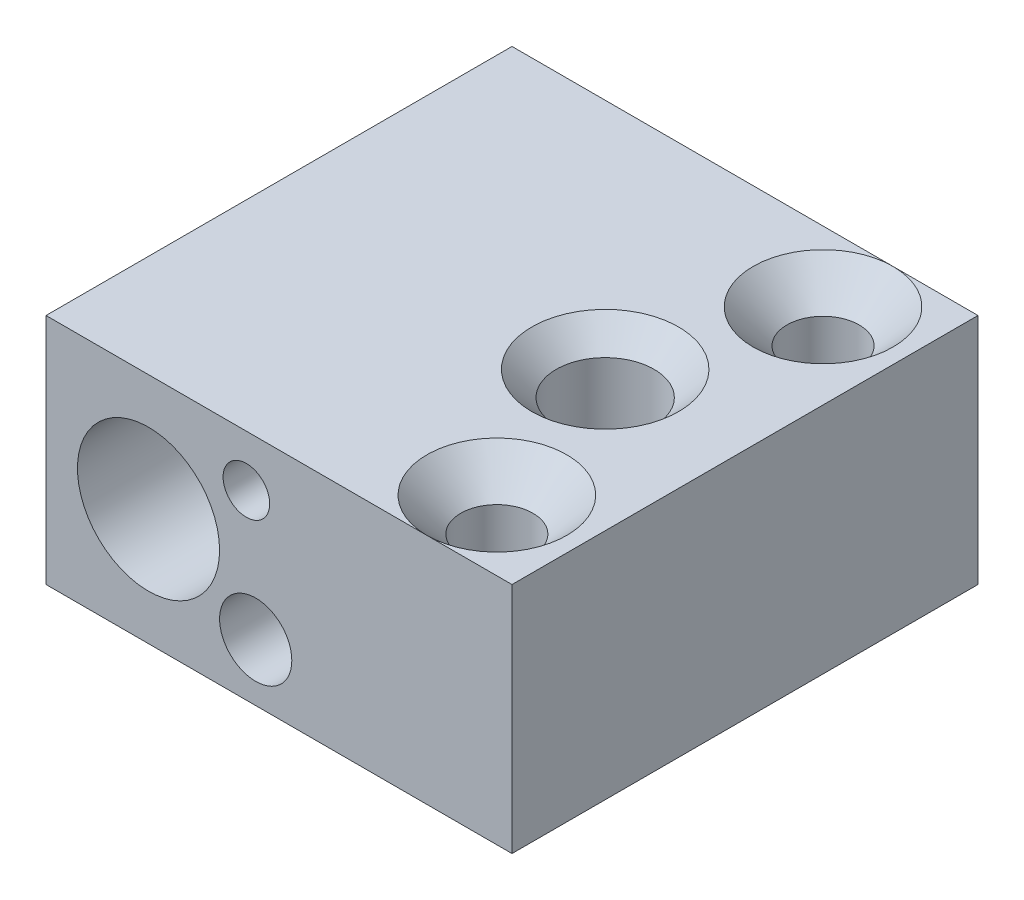
from build123d import *

# Parameters (mm, degrees)
SKETCH_1_W                   = 20
SKETCH_1_H                   = 20
EXTRUDE_1_DEPTH              = 10
M3X0_5_1_AT_2_COUNT          = 2
M3X0_5_1_AT_2_PITCH          = 14
CUT_EXTRUDE_1_REACH          = 26.495
SKETCH_6_R                   = 3.05
SKETCH_6_R_2                 = 1
SKETCH_6_R_3                 = 1.55
HOLE_WIZARD_M3_0_D           = 3.15
HOLE_WIZARD_M3_0_DEPTH       = 6.5
HOLE_WIZARD_M3_0_CSINK_D     = 3.2
HOLE_WIZARD_M3_0_CSINK_ANGLE = 90
HOLE_WIZARD_M3_0_TIP         = 0.946355475
CUT_EXTRUDE_2_DEPTH          = 0.01


with BuildPart() as part:
    # 草图1 → 凸台-拉伸1 (new body)
    with BuildSketch(Plane(origin=(0, 0, 0), x_dir=(1, 0, 0), z_dir=(0, 1, 0))):
        Rectangle(SKETCH_1_W, SKETCH_1_H)
    extrude(amount=EXTRUDE_1_DEPTH)

    # 草图3 → M3x0.5 螺纹孔的螺纹孔钻头1 (revolve, cut)
    with BuildSketch(Plane(origin=(6.35, 10, -7), x_dir=(0, 0, 1), z_dir=(1, 0, 0))):
        Polygon((0, 0), (0, 10), (2.05, 10), (1.55, 9.5), (1.55, 1.45), (3, 0), align=None)
    m3x0_5_1 = revolve(axis=Axis((6.35, 16.35, -7), (0, -1, 0)), mode=Mode.SUBTRACT)

    # M3x0.5 螺纹孔的螺纹孔钻头1 at 2: M3x0.5 螺纹孔的螺纹孔钻头1 ×2
    with Locations(*[(0, 0, i * M3X0_5_1_AT_2_PITCH) for i in range(1, M3X0_5_1_AT_2_COUNT)]):
        add(m3x0_5_1, mode=Mode.SUBTRACT)

    # 草图5 → M5x0.8 螺纹孔的螺纹孔钻头1 (revolve, cut)
    with BuildSketch(Plane(origin=(4, 10, 0), x_dir=(0, 0, 1), z_dir=(1, 0, 0))):
        Polygon((0, 0), (0, 10), (3.15, 10), (2.1, 8.95), (2.1, 1.05), (3.15, 0), align=None)
    revolve(axis=Axis((4, 16.35, 0), (0, -1, 0)), mode=Mode.SUBTRACT)

    # 草图6 → 切除-拉伸1 (cut, up to next)
    with BuildSketch(Plane.XY.offset(10), mode=Mode.PRIVATE) as cut_extrude_1_sk1:
        with Locations((-5.6, 5)):
            Circle(SKETCH_6_R)
    cut_extrude_1_tool1 = extrude(cut_extrude_1_sk1.sketch, amount=-CUT_EXTRUDE_1_REACH, mode=Mode.PRIVATE) & part.part
    # 草图6 → 切除-拉伸1 (cut, up to next)
    with BuildSketch(Plane.XY.offset(10), mode=Mode.PRIVATE) as cut_extrude_1_sk2:
        with Locations((-1.4, 7.8)):
            Circle(SKETCH_6_R_2)
    cut_extrude_1_tool2 = extrude(cut_extrude_1_sk2.sketch, amount=-CUT_EXTRUDE_1_REACH, mode=Mode.PRIVATE) & part.part
    # 草图6 → 切除-拉伸1 (cut, up to next)
    with BuildSketch(Plane.XY.offset(10), mode=Mode.PRIVATE) as cut_extrude_1_sk3:
        with Locations((-1, 2.45)):
            Circle(SKETCH_6_R_3)
    cut_extrude_1_tool3 = extrude(cut_extrude_1_sk3.sketch, amount=-CUT_EXTRUDE_1_REACH, mode=Mode.PRIVATE) & part.part
    add(cut_extrude_1_tool1.solids().sort_by_distance((-5.6, 5, 10))[0], mode=Mode.SUBTRACT)
    add(cut_extrude_1_tool2.solids().sort_by_distance((-1.4, 7.8, 10))[0], mode=Mode.SUBTRACT)
    add(cut_extrude_1_tool3.solids().sort_by_distance((-1, 2.45, 10))[0], mode=Mode.SUBTRACT)

    # M3 螺旋的螺纹孔钻头0
    with Locations(Plane(origin=(0, 0, -10), x_dir=(-1, 0, 0), z_dir=(0, 0, -1))):
        with Locations((-2.5, 5.15)):
            CounterSinkHole(HOLE_WIZARD_M3_0_D / 2, HOLE_WIZARD_M3_0_CSINK_D / 2, depth=HOLE_WIZARD_M3_0_DEPTH, counter_sink_angle=HOLE_WIZARD_M3_0_CSINK_ANGLE)
            with Locations((0, 0, -(HOLE_WIZARD_M3_0_DEPTH + HOLE_WIZARD_M3_0_TIP / 2))):  # 118° drill point
                Cone(0, HOLE_WIZARD_M3_0_D / 2, HOLE_WIZARD_M3_0_TIP, mode=Mode.SUBTRACT)

    # 草图9 → 切除-拉伸2 (cut)
    # profile 1 of 9: a face of its own
    with BuildSketch(Plane(origin=(-10, 0, 0), x_dir=(0, 0, -1), z_dir=(1, 0, 0))):
        with BuildLine():
            Line((6.2, 5.873660714), (6.2, 4.697767857))
            add(Edge.make_bspline(
                [(6.2, 4.697767857), (6.200358961, 4.687905196), (6.201044221, 4.669077299), (6.20807328, 4.642690439), (6.220616073, 4.620496734), (6.237482793, 4.602174231), (6.259354858, 4.587844853), (6.286176058, 4.578562792), (6.317246884, 4.572006842), (6.339542911, 4.57162866), (6.351339286, 4.571428571)],
                knots=[0, 0, 0, 0, 1.049174358, 2.002882139, 2.875847972, 3.739554377, 4.632018306, 5.630138028, 6.746154232, 8, 8, 8, 8], degree=3))
            Line((6.351339286, 4.571428571), (6.965625, 4.571428571))
            add(Edge.make_bspline(
                [(6.965625, 4.571428571), (6.984692148, 4.57167981), (7.022190938, 4.572173914), (7.077081365, 4.5787799), (7.129583034, 4.58858087), (7.179954451, 4.601711359), (7.227704243, 4.619904009), (7.273471708, 4.641119389), (7.316592255, 4.666841546), (7.35681122, 4.696114264), (7.393614648, 4.727736189), (7.425537291, 4.761587493), (7.452989619, 4.796390643), (7.475649375, 4.832635177), (7.492654307, 4.870743152), (7.505350768, 4.909892111), (7.512545921, 4.95063252), (7.513702063, 4.978098644), (7.514285714, 4.991964286)],
                knots=[0, 0, 0, 0, 1.195178097, 2.350521112, 3.461591556, 4.543710384, 5.609813756, 6.661895063, 7.703868969, 8.753007154, 9.778466156, 10.742320682, 11.666453728, 12.554833716, 13.415272869, 14.277128051, 15.130247646, 16, 16, 16, 16], degree=3))
            Line((7.514285714, 4.991964286), (7.514285714, 5.873660714))
            add(Edge.make_bspline(
                [(7.514285714, 5.873660714), (7.513814745, 5.88353703), (7.512912201, 5.902463568), (7.504887724, 5.928951372), (7.490887921, 5.951297107), (7.471572516, 5.969582588), (7.446702711, 5.983521083), (7.416621743, 5.99297665), (7.381521179, 5.999426123), (7.356283797, 5.999800713), (7.342857143, 6)],
                knots=[0, 0, 0, 0, 0.97678859, 1.871874803, 2.706162167, 3.561026909, 4.478761946, 5.504159065, 6.672176254, 8, 8, 8, 8], degree=3))
            add(Edge.make_bspline(
                [(7.342857143, 6), (7.331656067, 5.99979818), (7.310538866, 5.999417693), (7.281197761, 5.992928101), (7.255970172, 5.983358117), (7.235187208, 5.969229032), (7.219207986, 5.950861764), (7.207696491, 5.928562603), (7.2011353, 5.902301778), (7.200390794, 5.88351958), (7.2, 5.873660714)],
                knots=[0, 0, 0, 0, 1.229123109, 2.31724511, 3.286658509, 4.180915277, 5.050729611, 5.936409982, 6.916811699, 8, 8, 8, 8], degree=3))
            Line((7.2, 5.873660714), (7.2, 4.995089286))
            add(Edge.make_bspline(
                [(7.2, 4.995089286), (7.1992565, 4.983962511), (7.197783276, 4.961915105), (7.184808401, 4.930291872), (7.16345097, 4.901971327), (7.13540588, 4.876255756), (7.101116767, 4.854867922), (7.061525506, 4.839818381), (7.017870535, 4.830169041), (6.987256064, 4.829115897), (6.971428571, 4.828571429)],
                knots=[0, 0, 0, 0, 0.85076666, 1.685771294, 2.576038868, 3.553346086, 4.58889191, 5.654930637, 6.787613629, 8, 8, 8, 8], degree=3))
            Line((6.971428571, 4.828571429), (6.514285714, 4.828571429))
            Line((6.514285714, 4.828571429), (6.514285714, 5.873660714))
            add(Edge.make_bspline(
                [(6.514285714, 5.873660714), (6.513814745, 5.88353703), (6.512912201, 5.902463568), (6.504887724, 5.928951372), (6.490887921, 5.951297107), (6.471572516, 5.969582588), (6.446702711, 5.983521083), (6.416621743, 5.99297665), (6.381521179, 5.999426123), (6.356283797, 5.999800713), (6.342857143, 6)],
                knots=[0, 0, 0, 0, 0.97678859, 1.871874803, 2.706162167, 3.561026909, 4.478761946, 5.504159065, 6.672176254, 8, 8, 8, 8], degree=3))
            add(Edge.make_bspline(
                [(6.342857143, 6), (6.331656067, 5.99979818), (6.310538866, 5.999417693), (6.281197761, 5.992928101), (6.255970172, 5.983358117), (6.235187208, 5.969229032), (6.219207986, 5.950861764), (6.207696491, 5.928562603), (6.2011353, 5.902301778), (6.200390794, 5.88351958), (6.2, 5.873660714)],
                knots=[0, 0, 0, 0, 1.229123109, 2.31724511, 3.286658509, 4.180915277, 5.050729611, 5.936409982, 6.916811699, 8, 8, 8, 8], degree=3))
        make_face()
    # profile 2 of 9: a face of its own
    with BuildSketch(Plane(origin=(-10, 0, 0), x_dir=(0, 0, -1), z_dir=(1, 0, 0))):
        with BuildLine():
            add(Edge.make_bspline(
                [(4.974553571, 6), (4.957124363, 5.999714263), (4.922908577, 5.999153323), (4.872628726, 5.993032442), (4.824254567, 5.983757005), (4.77780629, 5.970811285), (4.733291916, 5.954400016), (4.691188532, 5.933541651), (4.650708817, 5.909438339), (4.612746848, 5.8814545), (4.577838429, 5.851109777), (4.546913183, 5.81883406), (4.521399376, 5.78416583), (4.500393363, 5.747902015), (4.483372575, 5.710031845), (4.472121526, 5.670145131), (4.464452907, 5.628567763), (4.463750811, 5.600184901), (4.463392857, 5.585714286)],
                knots=[0, 0, 0, 0, 1.143449473, 2.244738931, 3.319371146, 4.373930084, 5.40622561, 6.428398071, 7.453552806, 8.494819983, 9.519323088, 10.486637564, 11.422369572, 12.337066573, 13.233591591, 14.139221845, 15.051307659, 16, 16, 16, 16], degree=3))
            add(Edge.make_bspline(
                [(4.463392857, 5.585714286), (4.46427017, 5.567034275), (4.466017991, 5.529819148), (4.479537945, 5.475447451), (4.500992171, 5.422932414), (4.521904862, 5.391208133), (4.532589286, 5.375)],
                knots=[0, 0, 0, 0, 0.994021238, 1.980332219, 2.968139178, 4, 4, 4, 4], degree=3))
            add(Edge.make_bspline(
                [(4.532589286, 5.375), (4.545105477, 5.358698437), (4.569755236, 5.326593657), (4.6140221, 5.285253294), (4.662236341, 5.249669572), (4.715766025, 5.220818228), (4.773850951, 5.198542208), (4.83672638, 5.183189319), (4.903978296, 5.172912813), (4.950554544, 5.171933286), (4.974553571, 5.171428571)],
                knots=[0, 0, 0, 0, 0.972003009, 1.914291562, 2.85742328, 3.803578917, 4.785295332, 5.795591789, 6.864149528, 8, 8, 8, 8], degree=3))
            Line((4.974553571, 5.171428571), (5.428571429, 5.171428571))
            Line((5.428571429, 5.171428571), (5.428571429, 5))
            add(Edge.make_bspline(
                [(5.428571429, 5), (5.428024145, 4.988416293), (5.426948962, 4.965659149), (5.414042589, 4.933394578), (5.395295718, 4.903409999), (5.36855877, 4.877369474), (5.336639783, 4.855475783), (5.299773054, 4.83977679), (5.259114729, 4.830215878), (5.230708823, 4.829130643), (5.216071429, 4.828571429)],
                knots=[0, 0, 0, 0, 0.911088662, 1.78990857, 2.710600241, 3.692586731, 4.717568866, 5.756043047, 6.843702314, 8, 8, 8, 8], degree=3))
            Line((5.216071429, 4.828571429), (4.733482143, 4.828571429))
            add(Edge.make_bspline(
                [(4.733482143, 4.828571429), (4.721832943, 4.828373059), (4.699828634, 4.827998356), (4.66921151, 4.821431829), (4.642583123, 4.812118383), (4.621145286, 4.797449724), (4.604193008, 4.778903128), (4.592777222, 4.75601124), (4.585260005, 4.729336025), (4.584682036, 4.710177574), (4.584375, 4.7)],
                knots=[0, 0, 0, 0, 1.23741194, 2.337361837, 3.32016584, 4.221015329, 5.073621877, 5.966494756, 6.919737855, 8, 8, 8, 8], degree=3))
            add(Edge.make_bspline(
                [(4.584375, 4.7), (4.584724419, 4.689985241), (4.585391766, 4.670858324), (4.592532754, 4.644160759), (4.604509546, 4.621494572), (4.62081183, 4.602446442), (4.642872869, 4.588577854), (4.66900734, 4.57822655), (4.699934181, 4.572779208), (4.721856817, 4.571896606), (4.733482143, 4.571428571)],
                knots=[0, 0, 0, 0, 1.065522985, 2.035013566, 2.914736256, 3.780045738, 4.67296394, 5.66248319, 6.760441272, 8, 8, 8, 8], degree=3))
            Line((4.733482143, 4.571428571), (5.216071429, 4.571428571))
            add(Edge.make_bspline(
                [(5.216071429, 4.571428571), (5.234843058, 4.571673724), (5.271752536, 4.572155753), (5.325727389, 4.578843839), (5.377327799, 4.588326315), (5.426070813, 4.602405921), (5.472525729, 4.619532205), (5.515855931, 4.641870882), (5.557223257, 4.667134153), (5.595261292, 4.696601152), (5.629877844, 4.728328197), (5.659968696, 4.7620617), (5.685712318, 4.796863729), (5.706349096, 4.83336484), (5.722608216, 4.871074443), (5.734181528, 4.910179361), (5.741729602, 4.950602015), (5.742478964, 4.978091304), (5.742857143, 4.991964286)],
                knots=[0, 0, 0, 0, 1.202798304, 2.364986813, 3.482123764, 4.563358182, 5.61419173, 6.651071682, 7.683684711, 8.718015423, 9.730823015, 10.690367257, 11.612119412, 12.500887244, 13.372851679, 14.239212609, 15.111385823, 16, 16, 16, 16], degree=3))
            Line((5.742857143, 4.991964286), (5.742857143, 5.873660714))
            add(Edge.make_bspline(
                [(5.742857143, 5.873660714), (5.742386174, 5.88353703), (5.74148363, 5.902463568), (5.733459153, 5.928951372), (5.71945935, 5.951297107), (5.700143944, 5.969582588), (5.67527414, 5.983521083), (5.645193172, 5.99297665), (5.610092607, 5.999426123), (5.584855226, 5.999800713), (5.571428571, 6)],
                knots=[0, 0, 0, 0, 0.97678859, 1.871874803, 2.706162167, 3.561026909, 4.478761946, 5.504159065, 6.672176254, 8, 8, 8, 8], degree=3))
            Line((5.571428571, 6), (4.974553571, 6))
        make_face()
        with BuildLine():
            Line((5.428571429, 5.428571429), (4.974553571, 5.428571429))
            add(Edge.make_bspline(
                [(4.974553571, 5.428571429), (4.962591729, 5.429031936), (4.939274445, 5.429929605), (4.905625564, 5.438578661), (4.873911428, 5.451235836), (4.84558103, 5.470096113), (4.821227579, 5.492959644), (4.803117394, 5.52050683), (4.79266188, 5.55210769), (4.791315059, 5.574328961), (4.790625, 5.585714286)],
                knots=[0, 0, 0, 0, 1.06190605, 2.069979262, 3.072912099, 4.086186067, 5.078493479, 6.025723525, 6.988456646, 8, 8, 8, 8], degree=3))
            add(Edge.make_bspline(
                [(4.790625, 5.585714286), (4.791282423, 5.597107013), (4.792549247, 5.619060293), (4.803282122, 5.650383216), (4.821730283, 5.677566854), (4.846447866, 5.700556008), (4.875303006, 5.718839158), (4.906382455, 5.73320635), (4.939917338, 5.741332777), (4.962905287, 5.742344493), (4.974553571, 5.742857143)],
                knots=[0, 0, 0, 0, 1.014738308, 1.955355606, 2.912878804, 3.91792736, 4.945529001, 5.949963358, 6.961220564, 8, 8, 8, 8], degree=3))
            Line((4.974553571, 5.742857143), (5.428571429, 5.742857143))
            Line((5.428571429, 5.742857143), (5.428571429, 5.428571429))
        make_face(mode=Mode.SUBTRACT)
    # profile 3 of 9: a face of its own
    with BuildSketch(Plane(origin=(-10, 0, 0), x_dir=(0, 0, -1), z_dir=(1, 0, 0))):
        with BuildLine():
            Line((2.375446429, 4.571428571), (3.440625, 4.571428571))
            add(Edge.make_bspline(
                [(3.440625, 4.571428571), (3.459099096, 4.571678386), (3.495563252, 4.572171469), (3.548941907, 4.57884967), (3.600108736, 4.588301781), (3.648636881, 4.6025696), (3.695285609, 4.619516709), (3.739073765, 4.641854026), (3.780927045, 4.667252369), (3.819811521, 4.696567688), (3.855251887, 4.728349174), (3.886338333, 4.761889808), (3.912376351, 4.797001542), (3.934113241, 4.833203891), (3.950658491, 4.871078209), (3.962872298, 4.910098332), (3.970268451, 4.950611803), (3.971039465, 4.978094587), (3.971428571, 4.991964286)],
                knots=[0, 0, 0, 0, 1.180595153, 2.330257733, 3.435095254, 4.504320396, 5.561279663, 6.603920067, 7.64190357, 8.688661244, 9.712856461, 10.682646296, 11.607607273, 12.503575974, 13.377026726, 14.243869202, 15.113735859, 16, 16, 16, 16], degree=3))
            Line((3.971428571, 4.991964286), (3.971428571, 5.873660714))
            add(Edge.make_bspline(
                [(3.971428571, 5.873660714), (3.970957602, 5.88353703), (3.970055058, 5.902463568), (3.962030581, 5.928951372), (3.948030778, 5.951297107), (3.928715373, 5.969582588), (3.903845568, 5.983521083), (3.8737646, 5.99297665), (3.838664036, 5.999426123), (3.813426655, 5.999800713), (3.8, 6)],
                knots=[0, 0, 0, 0, 0.97678859, 1.871874803, 2.706162167, 3.561026909, 4.478761946, 5.504159065, 6.672176254, 8, 8, 8, 8], degree=3))
            add(Edge.make_bspline(
                [(3.8, 6), (3.788798924, 5.99979818), (3.767681723, 5.999417693), (3.738340618, 5.992928101), (3.713113029, 5.983358117), (3.692330065, 5.969229032), (3.676350843, 5.950861764), (3.664839348, 5.928562603), (3.658278157, 5.902301778), (3.657533652, 5.88351958), (3.657142857, 5.873660714)],
                knots=[0, 0, 0, 0, 1.229123109, 2.31724511, 3.286658509, 4.180915277, 5.050729611, 5.936409982, 6.916811699, 8, 8, 8, 8], degree=3))
            Line((3.657142857, 5.873660714), (3.657142857, 4.995089286))
            add(Edge.make_bspline(
                [(3.657142857, 4.995089286), (3.65631078, 4.983990985), (3.654659528, 4.961966476), (3.643074637, 4.930133062), (3.622932957, 4.901703443), (3.596698854, 4.875815973), (3.564222469, 4.854594791), (3.527097201, 4.839370922), (3.486146263, 4.830292287), (3.457636894, 4.829158963), (3.442857143, 4.828571429)],
                knots=[0, 0, 0, 0, 0.884123173, 1.754536936, 2.659184532, 3.6404337, 4.676625632, 5.729449407, 6.822907235, 8, 8, 8, 8], degree=3))
            Line((3.442857143, 4.828571429), (3.257142857, 4.828571429))
            Line((3.257142857, 4.828571429), (3.257142857, 5.873660714))
            add(Edge.make_bspline(
                [(3.257142857, 5.873660714), (3.256671888, 5.88353703), (3.255769344, 5.902463568), (3.247744867, 5.928951372), (3.233745064, 5.951297107), (3.214429659, 5.969582588), (3.189559854, 5.983521083), (3.159478886, 5.99297665), (3.124378322, 5.999426123), (3.09914094, 5.999800713), (3.085714286, 6)],
                knots=[0, 0, 0, 0, 0.97678859, 1.871874803, 2.706162167, 3.561026909, 4.478761946, 5.504159065, 6.672176254, 8, 8, 8, 8], degree=3))
            add(Edge.make_bspline(
                [(3.085714286, 6), (3.074513209, 5.99979818), (3.053396009, 5.999417693), (3.024054904, 5.992928101), (2.998827315, 5.983358117), (2.978044351, 5.969229032), (2.962065129, 5.950861764), (2.950553634, 5.928562603), (2.943992442, 5.902301778), (2.943247937, 5.88351958), (2.942857143, 5.873660714)],
                knots=[0, 0, 0, 0, 1.229123109, 2.31724511, 3.286658509, 4.180915277, 5.050729611, 5.936409982, 6.916811699, 8, 8, 8, 8], degree=3))
            Line((2.942857143, 5.873660714), (2.942857143, 4.828571429))
            Line((2.942857143, 4.828571429), (2.542857143, 4.828571429))
            Line((2.542857143, 4.828571429), (2.542857143, 5.873660714))
            add(Edge.make_bspline(
                [(2.542857143, 5.873660714), (2.542386174, 5.88353703), (2.54148363, 5.902463568), (2.533459153, 5.928951372), (2.51945935, 5.951297107), (2.500143944, 5.969582588), (2.47527414, 5.983521083), (2.445193172, 5.99297665), (2.410092607, 5.999426123), (2.384855226, 5.999800713), (2.371428571, 6)],
                knots=[0, 0, 0, 0, 0.97678859, 1.871874803, 2.706162167, 3.561026909, 4.478761946, 5.504159065, 6.672176254, 8, 8, 8, 8], degree=3))
            add(Edge.make_bspline(
                [(2.371428571, 6), (2.360227495, 5.99979818), (2.339110295, 5.999417693), (2.30976919, 5.992928101), (2.284541601, 5.983358117), (2.263758637, 5.969229032), (2.247779415, 5.950861764), (2.23626792, 5.928562603), (2.229706728, 5.902301778), (2.228962223, 5.88351958), (2.228571429, 5.873660714)],
                knots=[0, 0, 0, 0, 1.229123109, 2.31724511, 3.286658509, 4.180915277, 5.050729611, 5.936409982, 6.916811699, 8, 8, 8, 8], degree=3))
            Line((2.228571429, 5.873660714), (2.228571429, 4.697767857))
            add(Edge.make_bspline(
                [(2.228571429, 4.697767857), (2.228906106, 4.687893083), (2.229545008, 4.669042063), (2.236850163, 4.642949849), (2.248173602, 4.62042453), (2.264762123, 4.602039683), (2.286285044, 4.588201803), (2.312130589, 4.578405776), (2.342253878, 4.572038117), (2.363952072, 4.571639653), (2.375446429, 4.571428571)],
                knots=[0, 0, 0, 0, 1.0668989, 2.036718431, 2.909079601, 3.77651256, 4.684053597, 5.653873127, 6.75716759, 8, 8, 8, 8], degree=3))
        make_face()
    # profile 4 of 9: a face of its own
    with BuildSketch(Plane(origin=(-10, 0, 0), x_dir=(0, 0, -1), z_dir=(1, 0, 0))):
        with BuildLine():
            add(Edge.make_bspline(
                [(0.771428571, 4.697767857), (0.771819366, 4.687908991), (0.772563871, 4.669126794), (0.779125062, 4.642865968), (0.790636558, 4.620566808), (0.80661578, 4.602199539), (0.827398744, 4.588070454), (0.852626333, 4.578500471), (0.881967437, 4.572010878), (0.903084638, 4.571630391), (0.914285714, 4.571428571)],
                knots=[0, 0, 0, 0, 1.083188301, 2.063590018, 2.949270389, 3.819084723, 4.713341491, 5.68275489, 6.770876891, 8, 8, 8, 8], degree=3))
            Line((0.914285714, 4.571428571), (1.631696429, 4.571428571))
            add(Edge.make_bspline(
                [(1.631696429, 4.571428571), (1.645552726, 4.571893396), (1.671614228, 4.572767658), (1.70824117, 4.578198616), (1.739228921, 4.588293337), (1.765012737, 4.602378688), (1.785076056, 4.620884632), (1.79948289, 4.643802008), (1.808122369, 4.670680149), (1.808946229, 4.689963921), (1.809375, 4.7)],
                knots=[0, 0, 0, 0, 1.334268298, 2.509547337, 3.551531923, 4.456018457, 5.31762247, 6.148299713, 7.036298022, 8, 8, 8, 8], degree=3))
            Line((1.809375, 4.7), (1.809375, 4.897767857))
            add(Edge.make_bspline(
                [(1.809375, 4.897767857), (1.808947177, 4.907657001), (1.808125353, 4.926653468), (1.799476082, 4.953090324), (1.785063985, 4.975602623), (1.764848294, 4.993538003), (1.739336955, 5.007852482), (1.70808669, 5.017016928), (1.671698309, 5.023542618), (1.645571204, 5.023911336), (1.631696429, 5.024107143)],
                knots=[0, 0, 0, 0, 0.955698932, 1.835841596, 2.659849785, 3.51737335, 4.427828553, 5.472218496, 6.657623878, 8, 8, 8, 8], degree=3))
            add(Edge.make_bspline(
                [(1.631696429, 5.024107143), (1.620050141, 5.023904761), (1.598051332, 5.023522481), (1.567397746, 5.017006186), (1.540965638, 5.007558319), (1.51919792, 4.993496029), (1.502717174, 4.974995061), (1.490750899, 4.952725095), (1.483602406, 4.926472908), (1.482937556, 4.9076355), (1.482589286, 4.897767857)],
                knots=[0, 0, 0, 0, 1.248084459, 2.357521284, 3.348801845, 4.248524568, 5.108484738, 5.980827556, 6.942292255, 8, 8, 8, 8], degree=3))
            Line((1.482589286, 4.897767857), (1.482589286, 4.828571429))
            Line((1.482589286, 4.828571429), (1.085714286, 4.828571429))
            Line((1.085714286, 4.828571429), (1.085714286, 5.873660714))
            add(Edge.make_bspline(
                [(1.085714286, 5.873660714), (1.085243317, 5.88353703), (1.084340773, 5.902463568), (1.076316296, 5.928951372), (1.062316493, 5.951297107), (1.043001087, 5.969582588), (1.018131283, 5.983521083), (0.988050315, 5.99297665), (0.95294975, 5.999426123), (0.927712369, 5.999800713), (0.914285714, 6)],
                knots=[0, 0, 0, 0, 0.97678859, 1.871874803, 2.706162167, 3.561026909, 4.478761946, 5.504159065, 6.672176254, 8, 8, 8, 8], degree=3))
            add(Edge.make_bspline(
                [(0.914285714, 6), (0.903084638, 5.99979818), (0.881967437, 5.999417693), (0.852626333, 5.992928101), (0.827398744, 5.983358117), (0.80661578, 5.969229032), (0.790636558, 5.950861764), (0.779125062, 5.928562603), (0.772563871, 5.902301778), (0.771819366, 5.88351958), (0.771428571, 5.873660714)],
                knots=[0, 0, 0, 0, 1.229123109, 2.31724511, 3.286658509, 4.180915277, 5.050729611, 5.936409982, 6.916811699, 8, 8, 8, 8], degree=3))
            Line((0.771428571, 5.873660714), (0.771428571, 4.697767857))
        make_face()
    # profile 5 of 9: a face of its own
    with BuildSketch(Plane(origin=(-10, 0, 0), x_dir=(0, 0, -1), z_dir=(1, 0, 0))):
        with BuildLine():
            Line((-0.657142857, 5.428571429), (-0.657142857, 5.585714286))
            add(Edge.make_bspline(
                [(-0.657142857, 5.585714286), (-0.656485434, 5.597107013), (-0.65521861, 5.619060293), (-0.644485735, 5.650383216), (-0.626037574, 5.677566854), (-0.601319992, 5.700556008), (-0.572464851, 5.718839158), (-0.541385402, 5.73320635), (-0.507850519, 5.741332777), (-0.48486257, 5.742344493), (-0.473214286, 5.742857143)],
                knots=[0, 0, 0, 0, 1.014738308, 1.955355606, 2.912878804, 3.91792736, 4.945529001, 5.949963358, 6.961220564, 8, 8, 8, 8], degree=3))
            Line((-0.473214286, 5.742857143), (0.129910714, 5.742857143))
            add(Edge.make_bspline(
                [(0.129910714, 5.742857143), (0.143767012, 5.743321968), (0.169828514, 5.74419623), (0.206455456, 5.749627187), (0.237443206, 5.759721909), (0.263227023, 5.773807259), (0.283290342, 5.792313204), (0.297697176, 5.81523058), (0.306336655, 5.84210872), (0.307160515, 5.861392493), (0.307589286, 5.871428571)],
                knots=[0, 0, 0, 0, 1.334268298, 2.509547337, 3.551531923, 4.456018457, 5.31762247, 6.148299713, 7.036298022, 8, 8, 8, 8], degree=3))
            add(Edge.make_bspline(
                [(0.307589286, 5.871428571), (0.307207018, 5.881630574), (0.306482977, 5.900953852), (0.297433968, 5.927770223), (0.283618032, 5.950991711), (0.262901272, 5.968893679), (0.237713951, 5.983869278), (0.206271521, 5.992863098), (0.169921544, 5.999449661), (0.143788594, 5.999809113), (0.129910714, 6)],
                knots=[0, 0, 0, 0, 0.977065125, 1.850627041, 2.692664386, 3.543776324, 4.454537359, 5.491118492, 6.667660704, 8, 8, 8, 8], degree=3))
            Line((0.129910714, 6), (-0.473214286, 6))
            add(Edge.make_bspline(
                [(-0.473214286, 6), (-0.490644081, 5.999715787), (-0.524861018, 5.99915784), (-0.574987363, 5.993033063), (-0.623009532, 5.98392395), (-0.668656929, 5.970349192), (-0.712364765, 5.953374162), (-0.753761213, 5.932416779), (-0.793004119, 5.907703715), (-0.829288672, 5.879202794), (-0.862419095, 5.848273781), (-0.892043407, 5.815691032), (-0.916062052, 5.780407419), (-0.93643817, 5.743770141), (-0.952043216, 5.705208518), (-0.963360566, 5.664960412), (-0.970186445, 5.622852598), (-0.971010355, 5.594072862), (-0.971428571, 5.579464286)],
                knots=[0, 0, 0, 0, 1.150648774, 2.258872089, 3.330623802, 4.375631124, 5.399579733, 6.423764183, 7.435421073, 8.457811771, 9.466168756, 10.426886645, 11.359334413, 12.278687773, 13.191291171, 14.099916216, 15.03551861, 16, 16, 16, 16], degree=3))
            Line((-0.971428571, 5.579464286), (-0.971428571, 5.089732143))
            add(Edge.make_bspline(
                [(-0.971428571, 5.089732143), (-0.970978489, 5.071985221), (-0.970091842, 5.037024403), (-0.961108706, 4.985709483), (-0.947484779, 4.936322822), (-0.927651454, 4.889085589), (-0.901835393, 4.844209609), (-0.870806424, 4.801191031), (-0.834514189, 4.759877187), (-0.792760889, 4.721499194), (-0.74702073, 4.686415102), (-0.698348375, 4.655572272), (-0.647035122, 4.62929807), (-0.592887141, 4.608565183), (-0.536453304, 4.591983065), (-0.477512384, 4.579811491), (-0.415956155, 4.572585027), (-0.373977656, 4.571817832), (-0.352678571, 4.571428571)],
                knots=[0, 0, 0, 0, 0.948253417, 1.868026272, 2.777550642, 3.683586488, 4.599633316, 5.54051087, 6.516024553, 7.535353231, 8.568414496, 9.595079797, 10.613009471, 11.646070736, 12.691170439, 13.755635217, 14.8612524, 16, 16, 16, 16], degree=3))
            add(Edge.make_bspline(
                [(-0.352678571, 4.571428571), (-0.329586975, 4.571749293), (-0.284313188, 4.572378107), (-0.218106406, 4.580490633), (-0.154650849, 4.592114119), (-0.094311565, 4.609887917), (-0.03649903, 4.631550111), (0.018440421, 4.65851168), (0.070112806, 4.690799073), (0.118616878, 4.727136055), (0.162429627, 4.767024196), (0.201132381, 4.80905889), (0.233947264, 4.853011074), (0.261061401, 4.898675795), (0.281813971, 4.946558609), (0.29642518, 4.996195041), (0.305761427, 5.04756944), (0.306975732, 5.082400746), (0.307589286, 5.1)],
                knots=[0, 0, 0, 0, 1.180412772, 2.314337865, 3.407074127, 4.476660659, 5.527007273, 6.561849971, 7.601050391, 8.639274708, 9.65766677, 10.62742255, 11.557565914, 12.458312055, 13.337839754, 14.219275682, 15.100251381, 16, 16, 16, 16], degree=3))
            Line((0.307589286, 5.1), (0.307589286, 5.428571429))
            Line((0.307589286, 5.428571429), (-0.657142857, 5.428571429))
        make_face()
        with BuildLine():
            add(Edge.make_bspline(
                [(-0.352678571, 4.837946429), (-0.372427298, 4.838659326), (-0.411136493, 4.840056667), (-0.466801419, 4.855398155), (-0.519238481, 4.878091186), (-0.566243046, 4.910576961), (-0.606850365, 4.949558347), (-0.636141127, 4.995773049), (-0.653998702, 5.047399487), (-0.656076535, 5.083635967), (-0.657142857, 5.102232143)],
                knots=[0, 0, 0, 0, 1.054913213, 2.067720241, 3.070223263, 4.102438356, 5.111098638, 6.063944316, 7.006436856, 8, 8, 8, 8], degree=3))
            Line((-0.657142857, 5.102232143), (-0.657142857, 5.171428571))
            Line((-0.657142857, 5.171428571), (-0.019196429, 5.171428571))
            Line((-0.019196429, 5.171428571), (-0.019196429, 5.102232143))
            add(Edge.make_bspline(
                [(-0.019196429, 5.102232143), (-0.020436262, 5.084815601), (-0.022898182, 5.050231796), (-0.041821548, 5.000404691), (-0.073312738, 4.95505272), (-0.115707296, 4.914591049), (-0.166400256, 4.880573527), (-0.22381932, 4.855597031), (-0.286586784, 4.840581699), (-0.330273612, 4.838839779), (-0.352678571, 4.837946429)],
                knots=[0, 0, 0, 0, 0.886565171, 1.760441112, 2.678024654, 3.681472986, 4.731601057, 5.774770644, 6.858782491, 8, 8, 8, 8], degree=3))
        make_face(mode=Mode.SUBTRACT)
    # profile 6 of 9: a face of its own
    with BuildSketch(Plane(origin=(-10, 0, 0), x_dir=(0, 0, -1), z_dir=(1, 0, 0))):
        with BuildLine():
            add(Edge.make_bspline(
                [(-1.608482143, 4.571428571), (-1.594459831, 4.571625984), (-1.56803951, 4.57199794), (-1.531198616, 4.578514524), (-1.499547662, 4.587715852), (-1.473597835, 4.60185), (-1.453236013, 4.62012153), (-1.438506111, 4.642671044), (-1.429783178, 4.669478411), (-1.428988223, 4.688623139), (-1.428571429, 4.698660714)],
                knots=[0, 0, 0, 0, 1.341810883, 2.52819044, 3.574651646, 4.48751041, 5.335570714, 6.170213983, 7.040643772, 8, 8, 8, 8], degree=3))
            Line((-1.428571429, 4.698660714), (-1.428571429, 6.177232143))
            add(Edge.make_bspline(
                [(-1.428571429, 6.177232143), (-1.429157069, 6.191246037), (-1.430317186, 6.219006702), (-1.437458135, 6.260052864), (-1.450202997, 6.29956345), (-1.467630679, 6.337695656), (-1.490402773, 6.374330888), (-1.518101358, 6.409357936), (-1.550610018, 6.443243544), (-1.587853657, 6.474848307), (-1.628553375, 6.504329056), (-1.672569247, 6.529624206), (-1.718707072, 6.551759033), (-1.767407214, 6.569662757), (-1.818631255, 6.582862179), (-1.872032963, 6.592642327), (-1.927959222, 6.599272107), (-1.966200576, 6.599754067), (-1.985714286, 6.6)],
                knots=[0, 0, 0, 0, 0.868535433, 1.720515463, 2.572046281, 3.434392197, 4.312130073, 5.238138045, 6.196808919, 7.216967021, 8.261015794, 9.306407447, 10.358164474, 11.42879058, 12.515770889, 13.631661086, 14.791489489, 16, 16, 16, 16], degree=3))
            Line((-1.985714286, 6.6), (-2.485714286, 6.6))
            add(Edge.make_bspline(
                [(-2.485714286, 6.6), (-2.497363486, 6.59980163), (-2.519367795, 6.599426927), (-2.549984919, 6.592860401), (-2.576613306, 6.583546954), (-2.598051143, 6.568878295), (-2.615003421, 6.550331699), (-2.626419207, 6.527439812), (-2.633936424, 6.500764597), (-2.634514393, 6.481606145), (-2.634821429, 6.471428571)],
                knots=[0, 0, 0, 0, 1.23741194, 2.337361837, 3.32016584, 4.221015329, 5.073621877, 5.966494756, 6.919737855, 8, 8, 8, 8], degree=3))
            add(Edge.make_bspline(
                [(-2.634821429, 6.471428571), (-2.634472009, 6.461413813), (-2.633804663, 6.442286895), (-2.626663675, 6.415589331), (-2.614686883, 6.392923143), (-2.598384599, 6.373875013), (-2.57632356, 6.360006425), (-2.550189089, 6.349655121), (-2.519262248, 6.344207779), (-2.497339612, 6.343325177), (-2.485714286, 6.342857143)],
                knots=[0, 0, 0, 0, 1.065522985, 2.035013566, 2.914736256, 3.780045738, 4.67296394, 5.66248319, 6.760441272, 8, 8, 8, 8], degree=3))
            Line((-2.485714286, 6.342857143), (-1.971428571, 6.342857143))
            add(Edge.make_bspline(
                [(-1.971428571, 6.342857143), (-1.95575372, 6.342308351), (-1.925586665, 6.341252172), (-1.882206465, 6.331682217), (-1.842938092, 6.315486376), (-1.808309097, 6.293386235), (-1.77993946, 6.266934722), (-1.758331754, 6.237699109), (-1.745097077, 6.205370006), (-1.743601215, 6.182703395), (-1.742857143, 6.171428571)],
                knots=[0, 0, 0, 0, 1.189522375, 2.289296774, 3.353586148, 4.400871936, 5.392509308, 6.283423914, 7.146140844, 8, 8, 8, 8], degree=3))
            Line((-1.742857143, 6.171428571), (-1.742857143, 6))
            Line((-1.742857143, 6), (-2.214285714, 6))
            add(Edge.make_bspline(
                [(-2.214285714, 6), (-2.239025821, 5.999486001), (-2.287077442, 5.998487684), (-2.356751099, 5.988290795), (-2.421659074, 5.972557559), (-2.48180744, 5.950021767), (-2.537137558, 5.921124133), (-2.587001139, 5.884704913), (-2.632761651, 5.842806234), (-2.658459343, 5.810203897), (-2.671428571, 5.79375)],
                knots=[0, 0, 0, 0, 1.137321303, 2.208969146, 3.23166412, 4.204291973, 5.156593907, 6.093193188, 7.037664026, 8, 8, 8, 8], degree=3))
            add(Edge.make_bspline(
                [(-2.671428571, 5.79375), (-2.682412457, 5.777401262), (-2.70397774, 5.745302864), (-2.726309913, 5.692061132), (-2.740359431, 5.636593024), (-2.742020697, 5.598595827), (-2.742857143, 5.579464286)],
                knots=[0, 0, 0, 0, 1.0272123, 2.01678381, 3.001453084, 4, 4, 4, 4], degree=3))
            Line((-2.742857143, 5.579464286), (-2.742857143, 4.991964286))
            add(Edge.make_bspline(
                [(-2.742857143, 4.991964286), (-2.742472823, 4.977351773), (-2.741715054, 4.948540055), (-2.734356241, 4.906241604), (-2.722172707, 4.865860047), (-2.705623899, 4.827088029), (-2.684056497, 4.790430857), (-2.657704347, 4.755671286), (-2.62681223, 4.72252709), (-2.591240569, 4.691792626), (-2.552789256, 4.663229719), (-2.511594715, 4.638701497), (-2.46837981, 4.618008608), (-2.423226358, 4.60114882), (-2.376122192, 4.587496215), (-2.326764328, 4.578400566), (-2.275451518, 4.572288852), (-2.24049457, 4.571718034), (-2.222767857, 4.571428571)],
                knots=[0, 0, 0, 0, 0.942682178, 1.858701041, 2.761374061, 3.660769464, 4.573558634, 5.49964752, 6.471635859, 7.492843193, 8.530412402, 9.560124507, 10.582776776, 11.619456131, 12.668524753, 13.74434766, 14.856155803, 16, 16, 16, 16], degree=3))
            Line((-2.222767857, 4.571428571), (-1.608482143, 4.571428571))
        make_face()
        with BuildLine():
            Line((-1.742857143, 4.828571429), (-2.228571429, 4.828571429))
            add(Edge.make_bspline(
                [(-2.228571429, 4.828571429), (-2.241561863, 4.829041559), (-2.267090751, 4.829965462), (-2.304013729, 4.838557046), (-2.338068359, 4.853302673), (-2.369148059, 4.872574232), (-2.395842926, 4.896769354), (-2.414911021, 4.926006362), (-2.426879052, 4.958932735), (-2.427995053, 4.982186619), (-2.428571429, 4.994196429)],
                knots=[0, 0, 0, 0, 1.075823671, 2.114215862, 3.120150245, 4.140132259, 5.135190534, 6.079556429, 7.008158764, 8, 8, 8, 8], degree=3))
            Line((-2.428571429, 4.994196429), (-2.428571429, 5.577232143))
            add(Edge.make_bspline(
                [(-2.428571429, 5.577232143), (-2.428019928, 5.589103868), (-2.426943273, 5.612280197), (-2.414466441, 5.644806688), (-2.395294105, 5.67385435), (-2.368567302, 5.697881302), (-2.337681887, 5.717931665), (-2.303267885, 5.732076223), (-2.266737093, 5.741648013), (-2.241431372, 5.742449726), (-2.228571429, 5.742857143)],
                knots=[0, 0, 0, 0, 0.98224967, 1.917576607, 2.854211466, 3.851995098, 4.881407118, 5.901486107, 6.933570386, 8, 8, 8, 8], degree=3))
            Line((-2.228571429, 5.742857143), (-1.742857143, 5.742857143))
            Line((-1.742857143, 5.742857143), (-1.742857143, 4.828571429))
        make_face(mode=Mode.SUBTRACT)
    # profile 7 of 9: a face of its own
    with BuildSketch(Plane(origin=(-10, 0, 0), x_dir=(0, 0, -1), z_dir=(1, 0, 0))):
        with BuildLine():
            add(Edge.make_bspline(
                [(-4.485714286, 4.991964286), (-4.484892564, 4.972829365), (-4.483266757, 4.934970219), (-4.46908106, 4.879686924), (-4.446842702, 4.826570283), (-4.425272239, 4.794473112), (-4.414285714, 4.778125)],
                knots=[0, 0, 0, 0, 1.000436293, 1.979400181, 2.970844085, 4, 4, 4, 4], degree=3))
            add(Edge.make_bspline(
                [(-4.414285714, 4.778125), (-4.401327796, 4.76151966), (-4.37572176, 4.728705986), (-4.329956294, 4.686516611), (-4.279531863, 4.651068969), (-4.224413434, 4.62167533), (-4.164395718, 4.598948699), (-4.09947287, 4.58308625), (-4.02993244, 4.572949258), (-3.981882235, 4.571945415), (-3.957142857, 4.571428571)],
                knots=[0, 0, 0, 0, 0.967241414, 1.911357785, 2.849204526, 3.795104587, 4.776188471, 5.791859897, 6.863105543, 8, 8, 8, 8], degree=3))
            Line((-3.957142857, 4.571428571), (-3.485714286, 4.571428571))
            Line((-3.485714286, 4.571428571), (-3.485714286, 4.123660714))
            add(Edge.make_bspline(
                [(-3.485714286, 4.123660714), (-3.485350514, 4.11394153), (-3.484663246, 4.095579244), (-3.477812636, 4.069866148), (-3.466639342, 4.047849574), (-3.450487194, 4.029827051), (-3.42960311, 4.016293689), (-3.404590647, 4.006470636), (-3.375104791, 4.00075884), (-3.354044238, 4.000263251), (-3.342857143, 4)],
                knots=[0, 0, 0, 0, 1.076658512, 2.034112184, 2.927918047, 3.793351701, 4.68654704, 5.664854121, 6.759600556, 8, 8, 8, 8], degree=3))
            add(Edge.make_bspline(
                [(-3.342857143, 4), (-3.32942938, 4.00019823), (-3.304189917, 4.000570834), (-3.269102981, 4.007033308), (-3.23897908, 4.016447919), (-3.214335627, 4.030466422), (-3.194520044, 4.048299847), (-3.181081783, 4.070890957), (-3.172704472, 4.097192651), (-3.17186824, 4.116002905), (-3.171428571, 4.125892857)],
                knots=[0, 0, 0, 0, 1.329756651, 2.499474114, 3.526363897, 4.445434875, 5.291431906, 6.139486701, 7.021789506, 8, 8, 8, 8], degree=3))
            Line((-3.171428571, 4.125892857), (-3.171428571, 5.874107143))
            add(Edge.make_bspline(
                [(-3.171428571, 5.874107143), (-3.171838316, 5.883999902), (-3.17261954, 5.902861577), (-3.181471437, 5.92932113), (-3.196100465, 5.951726012), (-3.21633913, 5.970094879), (-3.242550516, 5.983590636), (-3.274030807, 5.992960027), (-3.31090422, 5.999416687), (-3.337319598, 5.999797753), (-3.351339286, 6)],
                knots=[0, 0, 0, 0, 0.949253824, 1.809860658, 2.648125936, 3.499866475, 4.409835833, 5.460838251, 6.652366208, 8, 8, 8, 8], degree=3))
            Line((-3.351339286, 6), (-3.965625, 6))
            add(Edge.make_bspline(
                [(-3.965625, 6), (-3.983351377, 5.999709351), (-4.018307662, 5.999136193), (-4.069625284, 5.993041469), (-4.119106541, 5.98385801), (-4.166407109, 5.970369103), (-4.211678732, 5.953407846), (-4.254905676, 5.932737172), (-4.296067615, 5.908170249), (-4.33454762, 5.879806673), (-4.369534723, 5.848751683), (-4.400799024, 5.816013762), (-4.427331697, 5.781302417), (-4.448394466, 5.74420613), (-4.465060886, 5.705586099), (-4.477204966, 5.665182201), (-4.484574386, 5.622889756), (-4.485330703, 5.594077216), (-4.485714286, 5.579464286)],
                knots=[0, 0, 0, 0, 1.143582147, 2.25513558, 3.330712021, 4.388778562, 5.425220418, 6.447638402, 7.477114605, 8.514446111, 9.52821109, 10.492974403, 11.432303303, 12.340069202, 13.239258557, 14.141724779, 15.057533786, 16, 16, 16, 16], degree=3))
            Line((-4.485714286, 5.579464286), (-4.485714286, 4.991964286))
        make_face()
        with BuildLine():
            add(Edge.make_bspline(
                [(-3.971428571, 4.828571429), (-3.984419006, 4.829041559), (-4.009947893, 4.829965462), (-4.046870872, 4.838557046), (-4.080925502, 4.853302673), (-4.112005202, 4.872574232), (-4.138700069, 4.896769354), (-4.157768164, 4.926006362), (-4.169736195, 4.958932735), (-4.170852196, 4.982186619), (-4.171428571, 4.994196429)],
                knots=[0, 0, 0, 0, 1.075823671, 2.114215862, 3.120150245, 4.140132259, 5.135190534, 6.079556429, 7.008158764, 8, 8, 8, 8], degree=3))
            Line((-4.171428571, 4.994196429), (-4.171428571, 5.577232143))
            add(Edge.make_bspline(
                [(-4.171428571, 5.577232143), (-4.170877071, 5.589103868), (-4.169800416, 5.612280197), (-4.157323584, 5.644806688), (-4.138151247, 5.67385435), (-4.111424445, 5.697881302), (-4.08053903, 5.717931665), (-4.046125028, 5.732076223), (-4.009594236, 5.741648013), (-3.984288515, 5.742449726), (-3.971428571, 5.742857143)],
                knots=[0, 0, 0, 0, 0.98224967, 1.917576607, 2.854211466, 3.851995098, 4.881407118, 5.901486107, 6.933570386, 8, 8, 8, 8], degree=3))
            Line((-3.971428571, 5.742857143), (-3.485714286, 5.742857143))
            Line((-3.485714286, 5.742857143), (-3.485714286, 4.828571429))
            Line((-3.485714286, 4.828571429), (-3.971428571, 4.828571429))
        make_face(mode=Mode.SUBTRACT)
    # profile 8 of 9: a face of its own
    with BuildSketch(Plane(origin=(-10, 0, 0), x_dir=(0, 0, -1), z_dir=(1, 0, 0))):
        with BuildLine():
            add(Edge.make_bspline(
                [(-5.457142857, 4.125892857), (-5.456780975, 4.11602304), (-5.456096841, 4.097364264), (-5.449213099, 4.071249684), (-5.438225979, 4.048783879), (-5.421768913, 4.030782926), (-5.401200487, 4.016619529), (-5.375936412, 4.007078882), (-5.346606611, 4.0005802), (-5.325487698, 4.00020109), (-5.314285714, 4)],
                knots=[0, 0, 0, 0, 1.085024322, 2.051225925, 2.952978328, 3.811998007, 4.707770554, 5.678827124, 6.768793509, 8, 8, 8, 8], degree=3))
            add(Edge.make_bspline(
                [(-5.314285714, 4), (-5.300857952, 4.00019823), (-5.275618488, 4.000570834), (-5.240531553, 4.007033308), (-5.210407651, 4.016447919), (-5.185764199, 4.030466422), (-5.165948615, 4.048299847), (-5.152510355, 4.070890957), (-5.144133043, 4.097192651), (-5.143296812, 4.116002905), (-5.142857143, 4.125892857)],
                knots=[0, 0, 0, 0, 1.329756651, 2.499474114, 3.526363897, 4.445434875, 5.291431906, 6.139486701, 7.021789506, 8, 8, 8, 8], degree=3))
            Line((-5.142857143, 4.125892857), (-5.142857143, 5.679910714))
            add(Edge.make_bspline(
                [(-5.142857143, 5.679910714), (-5.14254721, 5.684440794), (-5.141921148, 5.693591541), (-5.135603119, 5.706393702), (-5.125780896, 5.717789809), (-5.112409661, 5.72816313), (-5.09525622, 5.737520537), (-5.074085717, 5.745183222), (-5.049544926, 5.752535974), (-5.022223268, 5.757405187), (-4.994921604, 5.763450701), (-4.970181205, 5.77242863), (-4.948896168, 5.783222818), (-4.931951482, 5.797218295), (-4.917961585, 5.812859798), (-4.908823863, 5.831604159), (-4.902552147, 5.852128811), (-4.902046955, 5.866615772), (-4.901785714, 5.874107143)],
                knots=[0, 0, 0, 0, 0.637613823, 1.287977739, 1.975819578, 2.755596308, 3.670268896, 4.730566016, 5.937304331, 7.292510063, 8.656855052, 9.889790317, 11.011317773, 12.014840551, 12.985997572, 13.956468828, 14.943266914, 16, 16, 16, 16], degree=3))
            add(Edge.make_bspline(
                [(-4.901785714, 5.874107143), (-4.902184287, 5.884007334), (-4.902944213, 5.902883178), (-4.911916879, 5.929167775), (-4.925942278, 5.95187218), (-4.946213252, 5.969935516), (-4.971964888, 5.983629048), (-5.003050831, 5.992954108), (-5.039469453, 5.999422008), (-5.065591954, 5.999799522), (-5.079464286, 6)],
                knots=[0, 0, 0, 0, 0.956719681, 1.824095167, 2.661147087, 3.519586543, 4.424013239, 5.469518659, 6.656190132, 8, 8, 8, 8], degree=3))
            add(Edge.make_bspline(
                [(-5.079464286, 6), (-5.093312426, 5.999747955), (-5.120473751, 5.999253602), (-5.160184355, 5.995235864), (-5.197724299, 5.988418419), (-5.233294426, 5.979803531), (-5.266531363, 5.967508503), (-5.297695772, 5.952781003), (-5.327132713, 5.935881775), (-5.353794694, 5.91574929), (-5.377814579, 5.893298792), (-5.399723881, 5.869504035), (-5.416861842, 5.84254182), (-5.432117545, 5.814455515), (-5.442904191, 5.783612832), (-5.451849235, 5.75104601), (-5.455869058, 5.716019773), (-5.456712209, 5.692118521), (-5.457142857, 5.679910714)],
                knots=[0, 0, 0, 0, 1.189038671, 2.33214456, 3.422536679, 4.463903961, 5.470506639, 6.459433891, 7.421578647, 8.379982281, 9.320412371, 10.243669012, 11.147441324, 12.056258656, 12.982076347, 13.946001519, 14.950899397, 16, 16, 16, 16], degree=3))
            Line((-5.457142857, 5.679910714), (-5.457142857, 4.125892857))
        make_face()
    # profile 9 of 9: a face of its own
    with BuildSketch(Plane(origin=(-10, 0, 0), x_dir=(0, 0, -1), z_dir=(1, 0, 0))):
        with BuildLine():
            add(Edge.make_bspline(
                [(-5.914285714, 5.388392857), (-5.914898687, 5.408690125), (-5.916111716, 5.44885693), (-5.928059482, 5.50782288), (-5.94572334, 5.565094739), (-5.971425248, 5.620334197), (-6.004878864, 5.673049013), (-6.044998533, 5.724025634), (-6.09258252, 5.772616096), (-6.146810657, 5.818587027), (-6.205933098, 5.86109565), (-6.269128229, 5.898342441), (-6.335589316, 5.929533517), (-6.404984538, 5.95585755), (-6.477952297, 5.975098533), (-6.553875208, 5.989414787), (-6.632951908, 5.998759044), (-6.686878112, 5.999581827), (-6.714285714, 6)],
                knots=[0, 0, 0, 0, 0.873818044, 1.729221827, 2.583253825, 3.452776969, 4.346150102, 5.26874759, 6.243956721, 7.272206404, 8.329493241, 9.378929845, 10.429032671, 11.490532945, 12.573443396, 13.676677832, 14.819188371, 16, 16, 16, 16], degree=3))
            add(Edge.make_bspline(
                [(-6.714285714, 6), (-6.740353561, 5.999550794), (-6.791591286, 5.998667856), (-6.866934956, 5.989755567), (-6.939565824, 5.976178899), (-7.009278871, 5.95643924), (-7.076162729, 5.931314049), (-7.140332894, 5.90088646), (-7.201694894, 5.864701688), (-7.259010325, 5.822878421), (-7.312109458, 5.77802162), (-7.35816598, 5.729437334), (-7.398130932, 5.679073506), (-7.429750821, 5.6253631), (-7.455325824, 5.569890722), (-7.472522097, 5.511516905), (-7.483786312, 5.450881831), (-7.485065332, 5.409426558), (-7.485714286, 5.388392857)],
                knots=[0, 0, 0, 0, 1.145756602, 2.252044876, 3.33129865, 4.391884378, 5.433426423, 6.469528064, 7.510926223, 8.56063719, 9.586188976, 10.562725676, 11.499885799, 12.406604229, 13.296882722, 14.178704959, 15.075905828, 16, 16, 16, 16], degree=3))
            Line((-7.485714286, 5.388392857), (-7.485714286, 4.611607143))
            add(Edge.make_bspline(
                [(-7.485714286, 4.611607143), (-7.485044397, 4.59072786), (-7.483719485, 4.549432603), (-7.472639557, 4.488689128), (-7.454666236, 4.430471851), (-7.43015051, 4.374404858), (-7.397199021, 4.321603083), (-7.358459981, 4.270239132), (-7.311574574, 4.222187219), (-7.2586107, 4.177081892), (-7.201236104, 4.13530827), (-7.139889037, 4.09911343), (-7.075718253, 4.068676556), (-7.008956121, 4.043649295), (-6.939438265, 4.023747052), (-6.866931274, 4.010257627), (-6.791592255, 4.001328672), (-6.740353888, 4.000448035), (-6.714285714, 4)],
                knots=[0, 0, 0, 0, 0.917781798, 1.815198157, 2.70540181, 3.59322037, 4.497933981, 5.436506565, 6.417806253, 7.443604357, 8.493567445, 9.535215728, 10.57156622, 11.613358424, 12.667901236, 13.747414226, 14.853968209, 16, 16, 16, 16], degree=3))
            add(Edge.make_bspline(
                [(-6.714285714, 4), (-6.686732899, 4.000458135), (-6.632681231, 4.001356881), (-6.553272602, 4.01009384), (-6.477105026, 4.024243626), (-6.404272042, 4.044404469), (-6.334590814, 4.069868185), (-6.268233748, 4.101232634), (-6.205179828, 4.138501192), (-6.145798872, 4.180494), (-6.091707838, 4.226371946), (-6.044434842, 4.275275674), (-6.004474637, 4.326305408), (-5.971575098, 4.379249545), (-5.945669381, 4.434309259), (-5.927364909, 4.491609431), (-5.916316068, 4.551062202), (-5.914965946, 4.59132271), (-5.914285714, 4.611607143)],
                knots=[0, 0, 0, 0, 1.186309387, 2.327239569, 3.43592355, 4.51968926, 5.578144184, 6.627439548, 7.676069202, 8.728823373, 9.756282398, 10.726284281, 11.653215795, 12.542513466, 13.405557154, 14.266981084, 15.126853866, 16, 16, 16, 16], degree=3))
            Line((-5.914285714, 4.611607143), (-5.914285714, 5.388392857))
        make_face()
        with BuildLine():
            Line((-6.228571429, 5.385714286), (-6.228571429, 4.614285714))
            add(Edge.make_bspline(
                [(-6.228571429, 4.614285714), (-6.228978536, 4.602197263), (-6.229784097, 4.578277306), (-6.236883301, 4.543238161), (-6.247493116, 4.509408979), (-6.2628747, 4.477001815), (-6.282882693, 4.445994474), (-6.306904468, 4.415987064), (-6.335882988, 4.387973932), (-6.368284966, 4.361180265), (-6.404150218, 4.337076457), (-6.442176791, 4.315325874), (-6.48266422, 4.297536615), (-6.52509074, 4.282883392), (-6.569507456, 4.271054576), (-6.616005071, 4.26330353), (-6.66447021, 4.258195016), (-6.697456695, 4.257498305), (-6.714285714, 4.257142857)],
                knots=[0, 0, 0, 0, 0.868391662, 1.718325355, 2.560952892, 3.412972149, 4.288651142, 5.209455388, 6.170419055, 7.181547187, 8.229214741, 9.273762846, 10.327641599, 11.40377536, 12.49905056, 13.628449504, 14.7900842, 16, 16, 16, 16], degree=3))
            add(Edge.make_bspline(
                [(-6.714285714, 4.257142857), (-6.729769496, 4.257558908), (-6.760204729, 4.258376706), (-6.805186845, 4.262667449), (-6.848236213, 4.270888248), (-6.889851985, 4.281470909), (-6.929457507, 4.295702076), (-6.967147999, 4.313485493), (-7.003623443, 4.333347846), (-7.037523786, 4.356926051), (-7.068791226, 4.382565502), (-7.096184397, 4.410386257), (-7.119688799, 4.439853177), (-7.138502165, 4.471479408), (-7.153523437, 4.504650157), (-7.163580546, 4.539716854), (-7.170157055, 4.576391772), (-7.170998164, 4.601458633), (-7.171428571, 4.614285714)],
                knots=[0, 0, 0, 0, 1.151714698, 2.263833724, 3.355560458, 4.407703528, 5.45430359, 6.479148831, 7.504531625, 8.538950899, 9.54492254, 10.507409934, 11.437217197, 12.340571417, 13.237190441, 14.137081309, 15.046717107, 16, 16, 16, 16], degree=3))
            Line((-7.171428571, 4.614285714), (-7.171428571, 5.385714286))
            add(Edge.make_bspline(
                [(-7.171428571, 5.385714286), (-7.17098268, 5.398538266), (-7.170106212, 5.423745781), (-7.163717563, 5.46046574), (-7.15342034, 5.495468072), (-7.13851415, 5.528523963), (-7.119685293, 5.560145543), (-7.096186101, 5.589615459), (-7.06878791, 5.617428657), (-7.037535946, 5.643096823), (-7.003684137, 5.666490696), (-6.967431061, 5.686781808), (-6.929650234, 5.704047484), (-6.890069154, 5.718735807), (-6.848494597, 5.728954006), (-6.805354789, 5.7374383), (-6.760347867, 5.741586659), (-6.729767847, 5.742430115), (-6.714285714, 5.742857143)],
                knots=[0, 0, 0, 0, 0.95321594, 1.873693335, 2.762913086, 3.659469136, 4.56275991, 5.492501869, 6.454921662, 7.46082265, 8.495169272, 9.510821522, 10.54564153, 11.581762231, 12.644541973, 13.725314429, 14.848366192, 16, 16, 16, 16], degree=3))
            add(Edge.make_bspline(
                [(-6.714285714, 5.742857143), (-6.697457455, 5.74249476), (-6.66432439, 5.741781265), (-6.615702086, 5.736737616), (-6.569066719, 5.728926776), (-6.524760953, 5.717208913), (-6.482551459, 5.702360144), (-6.442173004, 5.684686069), (-6.404149536, 5.662921705), (-6.368291424, 5.638815162), (-6.335859339, 5.612044918), (-6.307069641, 5.584027548), (-6.282738003, 5.554419448), (-6.262906287, 5.523424753), (-6.24738507, 5.490926202), (-6.236964776, 5.456883824), (-6.229770477, 5.421727184), (-6.228973964, 5.397804244), (-6.228571429, 5.385714286)],
                knots=[0, 0, 0, 0, 1.209731718, 2.381834003, 3.511061116, 4.606169675, 5.672038989, 6.725757401, 7.770146583, 8.817654741, 9.828629035, 10.789446497, 11.701805236, 12.577351, 13.429240627, 14.281936078, 15.131740458, 16, 16, 16, 16], degree=3))
        make_face(mode=Mode.SUBTRACT)
    extrude(amount=CUT_EXTRUDE_2_DEPTH, mode=Mode.SUBTRACT)


solid = part.part
